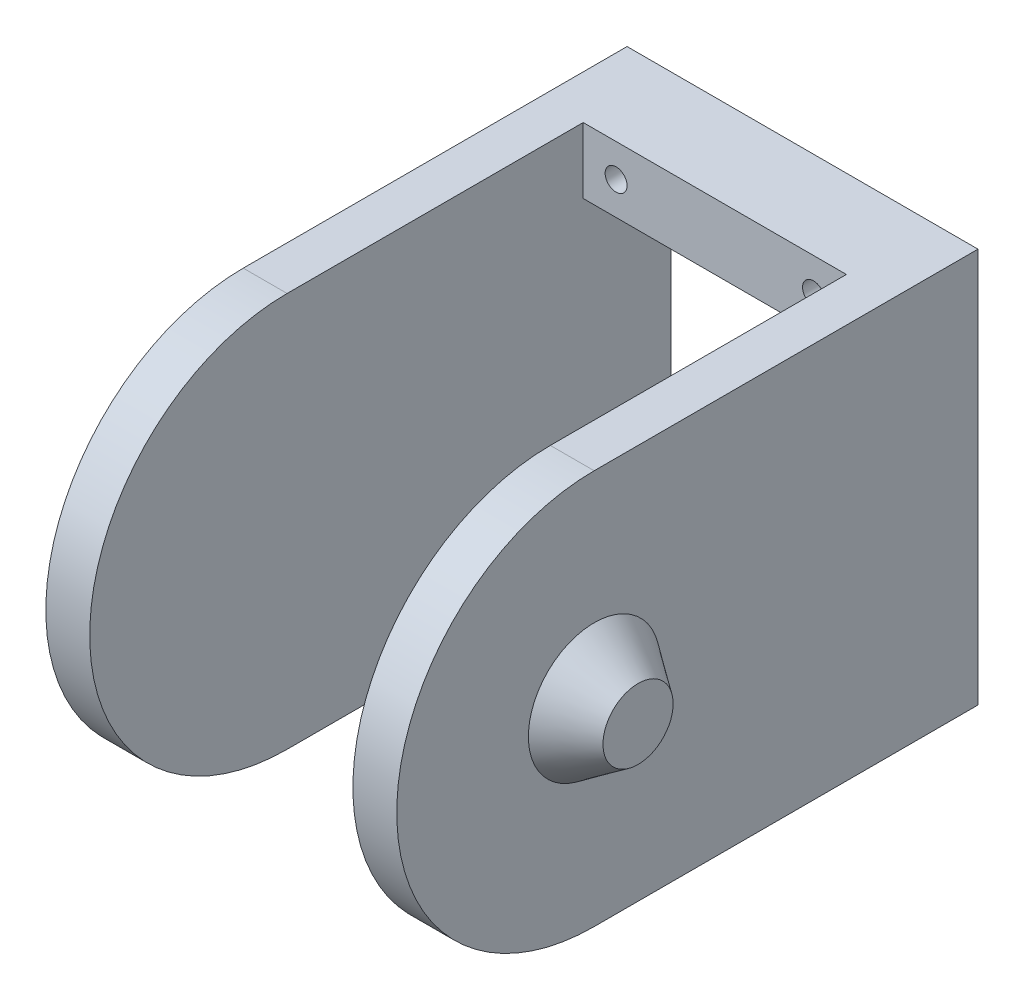
from build123d import *

# Parameters (mm, degrees)
SKETCH1_W                                  = 16
SKETCH1_H                                  = 18
SKETCH1_W_2                                = 12
SKETCH1_H_2                                = 14
EXTRUDE_THIN1_DEPTH                        = 2
BOSS_EXTRUDE1_DEPTH                        = 2
SKETCH3_R                                  = 3
BOSS_EXTRUDE2_DEPTH                        = 2
BOSS_EXTRUDE2_TAPER                        = 35
SKETCH13_W                                 = 12
SKETCH13_H                                 = 1
BOSS_EXTRUDE4_DEPTH                        = 4
CUT_EXTRUDE5_REACH                         = 28.215
SKETCH11_R                                 = 0.5
MIRROR4_AT_THE_SECOND_PLANE_COPY_1_REACH   = 28.215
MIRROR4_AT_THE_SECOND_PLANE_COPY_1_SKETC_R = 0.5


with BuildPart() as part:
    # Sketch1 → Extrude-Thin1 (new, symmetric)
    with BuildSketch(Plane.XY):
        Rectangle(SKETCH1_W, SKETCH1_H)
        Rectangle(SKETCH1_W_2, SKETCH1_H_2, mode=Mode.SUBTRACT)
    extrude_thin1 = extrude(amount=EXTRUDE_THIN1_DEPTH, both=True)

    # Sketch2 → Boss-Extrude1 (add)
    with BuildSketch(Plane(origin=(8, 0, 0), x_dir=(0, 0, -1), z_dir=(1, 0, 0))):
        with BuildLine():
            Line((2, 9), (-15.5, 9))
            ThreePointArc((-15.5, 9), (-24.5, 0), (-15.5, -9))
            Line((-15.5, -9), (2, -9))
            Line((2, -9), (2, 9))
        make_face()
    boss_extrude1 = extrude(amount=-BOSS_EXTRUDE1_DEPTH)

    # Sketch3 → Boss-Extrude2 (add)
    with BuildSketch(Plane(origin=(8, 0, 0), x_dir=(0, 0, -1), z_dir=(1, 0, 0))):
        with Locations((-15.5, 0)):
            Circle(SKETCH3_R)
    boss_extrude2 = extrude(amount=BOSS_EXTRUDE2_DEPTH, taper=BOSS_EXTRUDE2_TAPER)

    # Mirror3: Extrude-Thin1, Boss-Extrude1, Boss-Extrude2 across plane
    add(extrude_thin1.mirror(Plane(origin=(0, 0, 0), x_dir=(0, 0, 1), z_dir=(1, 0, 0))))
    add(boss_extrude1.mirror(Plane(origin=(0, 0, 0), x_dir=(0, 0, 1), z_dir=(1, 0, 0))))
    add(boss_extrude2.mirror(Plane(origin=(0, 0, 0), x_dir=(0, 0, 1), z_dir=(1, 0, 0))))

    # Sketch13 → Boss-Extrude4 (add)
    with BuildSketch(Plane.XY.offset(2)):
        with Locations((0, 6.5)):
            Rectangle(SKETCH13_W, SKETCH13_H)
    boss_extrude4 = extrude(amount=-BOSS_EXTRUDE4_DEPTH)

    # Mirror5: Boss-Extrude4 across plane
    add(boss_extrude4.mirror(Plane.ZX))

    # Sketch11 → Cut-Extrude5 (cut, up to next)
    with BuildSketch(Plane.XY.offset(2), mode=Mode.PRIVATE) as cut_extrude5_sk1:
        with Locations((-4.5, 7.5)):
            Circle(SKETCH11_R)
    cut_extrude5_tool1 = extrude(cut_extrude5_sk1.sketch, amount=-CUT_EXTRUDE5_REACH, mode=Mode.PRIVATE) & part.part
    cut_extrude5 = cut_extrude5_tool1.solids().sort_by_distance((-4.5, 7.5, 2))[0]
    add(cut_extrude5, mode=Mode.SUBTRACT)

    # Mirror4: Cut-Extrude5 across plane
    add(cut_extrude5.mirror(Plane.ZX), mode=Mode.SUBTRACT)

    # Mirror4 at the second plane: Cut-Extrude5 across plane
    add(cut_extrude5.mirror(Plane(origin=(0, 0, 0), x_dir=(0, 0, 1), z_dir=(1, 0, 0))), mode=Mode.SUBTRACT)

    # Mirror4 at the second plane copy 1 sketc → Mirror4 at the second plane copy 1 (cut, up to next)
    with BuildSketch(Plane(origin=(0, 0, 2), x_dir=(-1, 0, 0), z_dir=(0, 0, 1)), mode=Mode.PRIVATE) as mirror4_at_the_second_plane_copy_1_sk1:
        with Locations((-4.5, 7.5)):
            Circle(MIRROR4_AT_THE_SECOND_PLANE_COPY_1_SKETC_R)
    mirror4_at_the_second_plane_copy_1_tool1 = extrude(mirror4_at_the_second_plane_copy_1_sk1.sketch, amount=-MIRROR4_AT_THE_SECOND_PLANE_COPY_1_REACH, mode=Mode.PRIVATE) & part.part
    add(mirror4_at_the_second_plane_copy_1_tool1.solids().sort_by_distance((4.5, -7.5, 2))[0], mode=Mode.SUBTRACT)


solid = part.part
